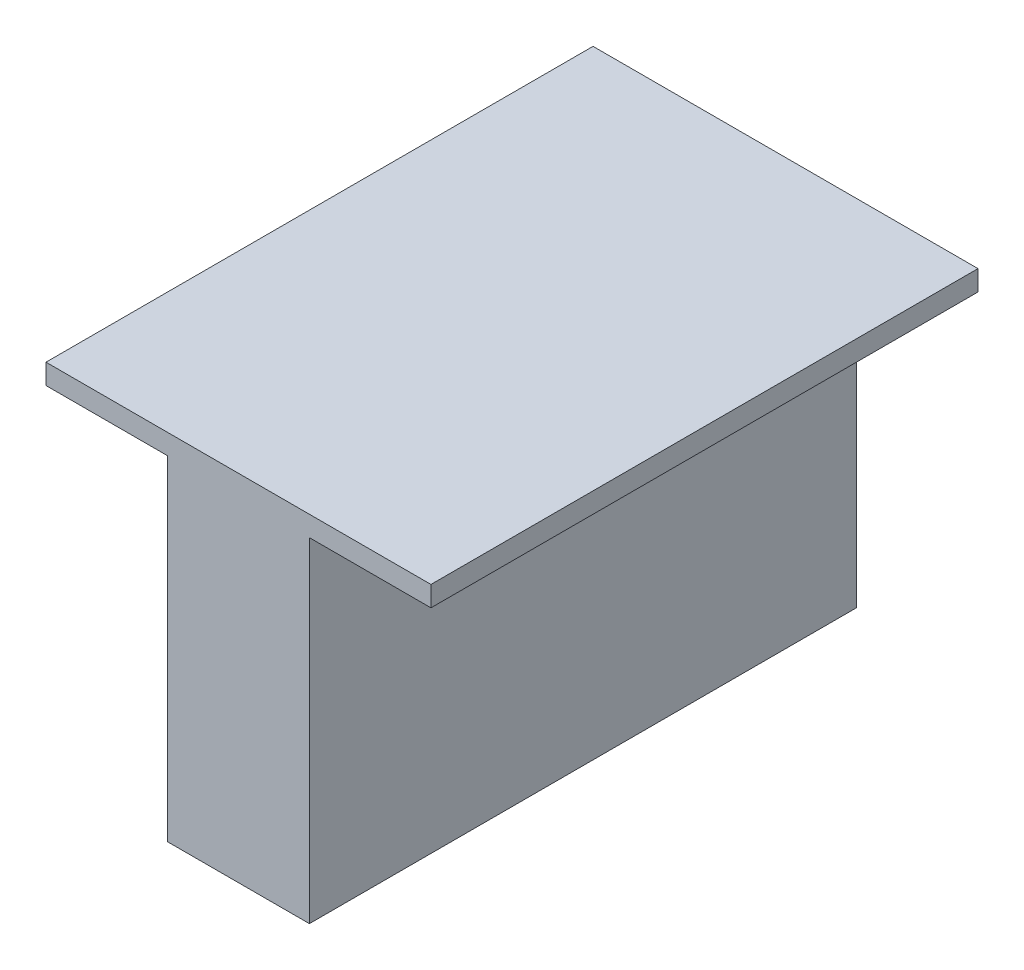
from build123d import *

# Parameters (mm, degrees)
SKETCH1_W           = 14
SKETCH1_H           = 54
BOSS_EXTRUDE2_DEPTH = 35
SHELL2_T            = -5
SKETCH2_W           = 54
SKETCH2_H           = 2
BOSS_EXTRUDE3_DEPTH = 12
SKETCH3_W           = 54
SKETCH3_H           = 2
BOSS_EXTRUDE4_DEPTH = 12


with BuildPart() as part:
    # Sketch1 → Boss-Extrude2 (new body)
    with BuildSketch(Plane(origin=(0, 0, 0), x_dir=(1, 0, 0), z_dir=(0, 1, 0))):
        with Locations((7, 27)):
            Rectangle(SKETCH1_W, SKETCH1_H)
    extrude(amount=BOSS_EXTRUDE2_DEPTH)

    # Shell2
    shell2_openings = [part.faces().sort_by_distance(p)[0] for p in [
        (7, 0, -27),
    ]]
    offset(amount=SHELL2_T, openings=shell2_openings, kind=Kind.INTERSECTION)

    # Sketch2 → Boss-Extrude3 (add)
    with BuildSketch(Plane.ZY):
        with Locations((-27, 34)):
            Rectangle(SKETCH2_W, SKETCH2_H)
    extrude(amount=BOSS_EXTRUDE3_DEPTH)

    # Sketch3 → Boss-Extrude4 (add)
    with BuildSketch(Plane(origin=(14, 0, 0), x_dir=(0, 0, -1), z_dir=(1, 0, 0))):
        with Locations((27, 34)):
            Rectangle(SKETCH3_W, SKETCH3_H)
    extrude(amount=BOSS_EXTRUDE4_DEPTH)


solid = part.part
